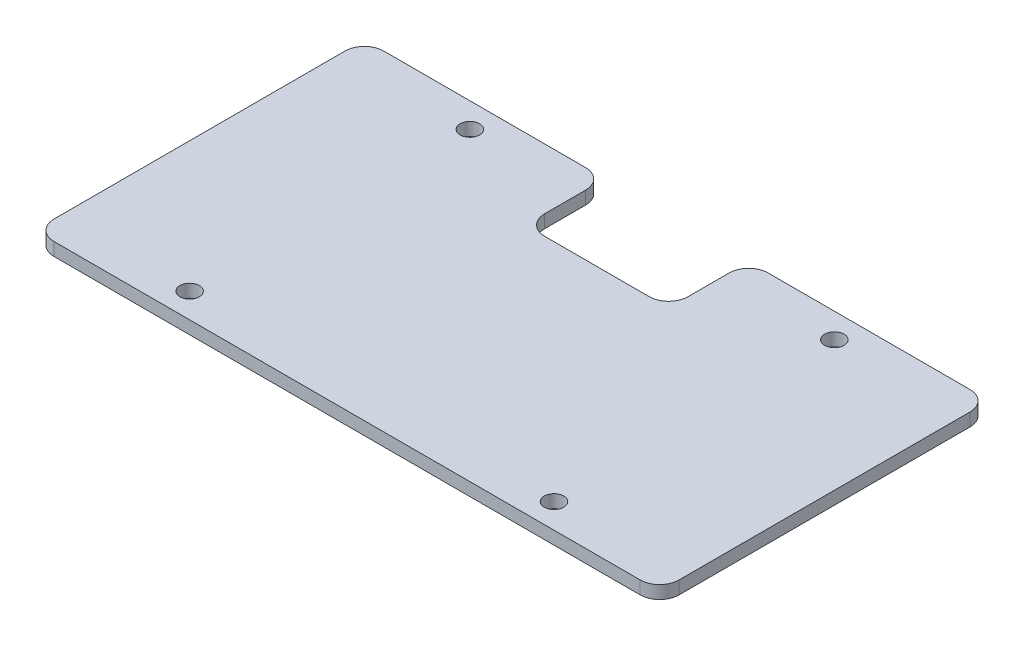
from build123d import *

# Parameters (mm, degrees)
SKETCH_1_R      = 1.5
EXTRUDE_1_DEPTH = 2
FILLET_1_R      = 3


with BuildPart() as part:
    # 草图1 → 凸台-拉伸1 (new body)
    with BuildSketch(Plane(origin=(0, 0, 0), x_dir=(1, 0, 0), z_dir=(0, 1, 0))):
        Polygon((0, 0), (96.27, 0), (96.27, 50.8), (59.18, 50.8), (59.18, 38.48), (37.08, 38.48), (37.08, 50.8), (0, 50.8), align=None)
        with Locations(Location((20.063894942, 46.982706601, 0), (0, 0, 270))):
            Circle(SKETCH_1_R, mode=Mode.SUBTRACT)
        with Locations(Location((76.193894468, 46.99, 0), (0, 0, 90))):
            Circle(SKETCH_1_R, mode=Mode.SUBTRACT)
        with Locations(Location((76.193894468, 3.81, 0), (0, 0, 270))):
            Circle(SKETCH_1_R, mode=Mode.SUBTRACT)
        with Locations(Location((20.063894942, 3.817293399, 0), (0, 0, 270))):
            Circle(SKETCH_1_R, mode=Mode.SUBTRACT)
    extrude(amount=EXTRUDE_1_DEPTH)

    # 圆角1
    fillet_1_edges = [part.edges().sort_by_distance(p)[0] for p in [
        (37.08, 1, -50.8),
        (37.08, 1, -38.48),
        (59.18, 1, -38.48),
        (59.18, 1, -50.8),
        (96.27, 1, -50.8),
        (96.27, 1, 0),
        (0, 1, 0),
        (0, 1, -50.8),
    ]]
    fillet(fillet_1_edges, radius=FILLET_1_R)


solid = part.part
